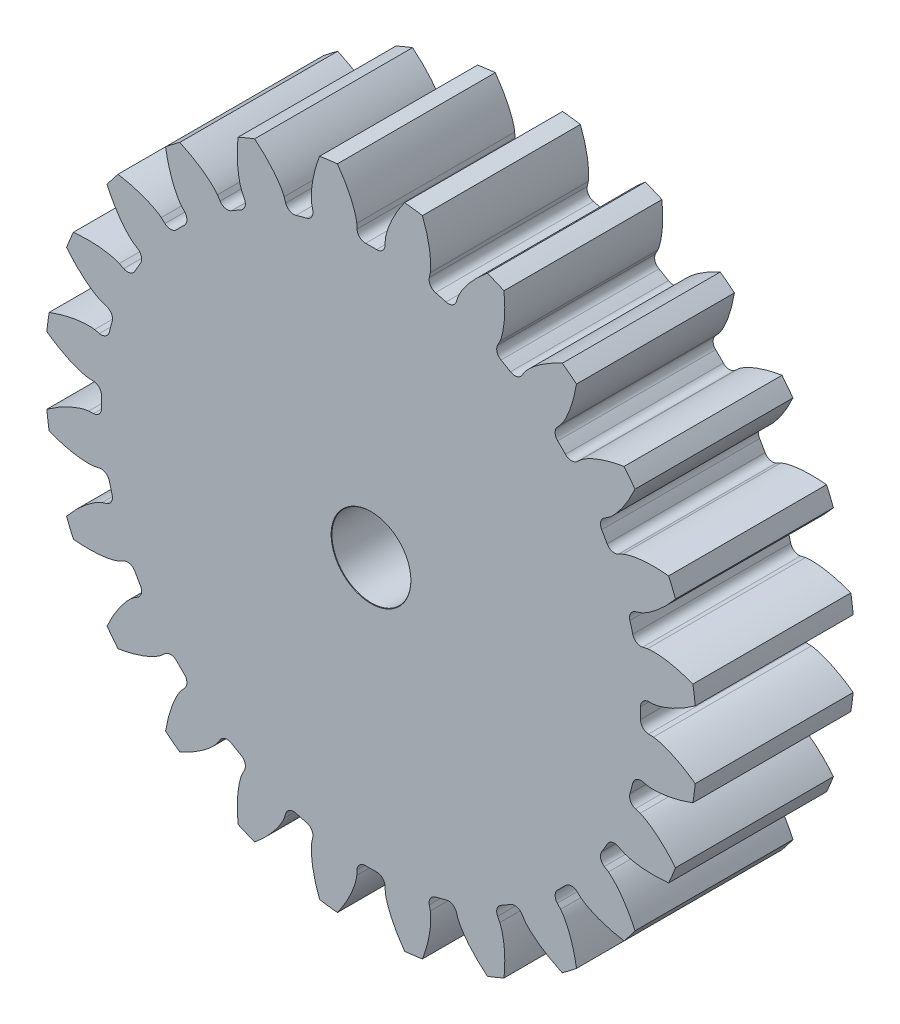
from build123d import *

# Parameters (mm, degrees)
BOSS_EXTRUDE1_DEPTH             = 5
BOSS_EXTRUDE1_DEPTH_BACK        = 5
SKETCH3_R                       = 20.6375
CUT_EXTRUDE1_DEPTH              = 30.611025185
FILLET1_R                       = 0.532614244
CIRPATTERN1_COUNT               = 24
FILLET1_OF_CIRPATTERN1_R        = 0.532614244
F_5_0MM_DOWEL_HOLE1_D           = 5
F_5_0MM_DOWEL_HOLE1_CSINK_D     = 5.05
F_5_0MM_DOWEL_HOLE1_CSINK_ANGLE = 90


with BuildPart() as part:
    # Sketch3 → Boss-Extrude1 (new, two sides: drawn at the far end of the back side and taken through both)
    with BuildSketch(Plane.XY.offset(-BOSS_EXTRUDE1_DEPTH_BACK)):
        Circle(SKETCH3_R)
    extrude(amount=BOSS_EXTRUDE1_DEPTH + BOSS_EXTRUDE1_DEPTH_BACK)

    # Sketch4 → Cut-Extrude1 (cut, symmetric)
    with BuildSketch(Plane.XY):
        with BuildLine():
            Line((17.043829637, 0.862222668), (17.87828198, 0.904436404))
            add(Edge.make_bspline(
                [(17.87828198, 0.904436404), (17.882628975, 0.904709236), (17.894811472, 0.905637892), (17.917802567, 0.908038849), (17.955248389, 0.912872306), (18.002847526, 0.920376051), (18.064221674, 0.931617626), (18.136311779, 0.946842659), (18.215294146, 0.965648432), (18.300937276, 0.988342964), (18.386106336, 1.012957224), (18.470794937, 1.039344617), (18.554900966, 1.067282274), (18.656456709, 1.103071674), (18.777769061, 1.148692039), (18.918838907, 1.20594527), (19.077937562, 1.275508259), (19.239059471, 1.351335813), (19.396736576, 1.429996177), (19.554985161, 1.514102946), (19.707341339, 1.598760729), (19.864426037, 1.691410754), (20.008834587, 1.779332437), (20.169260177, 1.883028122), (20.298332453, 1.968229709), (20.430478039, 2.060551994), (20.494617005, 2.106120696), (20.527320467, 2.129676191)],
                knots=[0, 0, 0, 0, 0, 0.005376749, 0.015083688, 0.02853182, 0.04661014, 0.064854849, 0.092110526, 0.119476176, 0.146842496, 0.174208854, 0.201574956, 0.228941013, 0.256307345, 0.307035032, 0.361767352, 0.416499661, 0.471231937, 0.525964282, 0.580696616, 0.635428982, 0.690161387, 0.744893688, 0.799626082, 0.854358407, 0.909090914, 0.909090914, 0.909090914, 0.909090914, 0.909090914], degree=4))
            ThreePointArc((20.527320467, 2.129676191), (20.6375, 0), (20.527320467, -2.129676191))
            add(Edge.make_bspline(
                [(17.87828198, -0.904436404), (17.882628975, -0.904709236), (17.894811472, -0.905637892), (17.917802567, -0.908038849), (17.955248389, -0.912872306), (18.002847526, -0.920376051), (18.064221674, -0.931617626), (18.136311779, -0.946842659), (18.215294146, -0.965648432), (18.300937276, -0.988342964), (18.386106336, -1.012957224), (18.470794937, -1.039344617), (18.554900966, -1.067282274), (18.656456709, -1.103071674), (18.777769061, -1.148692039), (18.918838907, -1.20594527), (19.077937562, -1.275508259), (19.239059471, -1.351335813), (19.396736576, -1.429996177), (19.554985161, -1.514102946), (19.707341339, -1.598760729), (19.864426037, -1.691410754), (20.008834587, -1.779332437), (20.169260177, -1.883028122), (20.298332453, -1.968229709), (20.430478039, -2.060551994), (20.494617005, -2.106120696), (20.527320467, -2.129676191)],
                knots=[0, 0, 0, 0, 0, 0.005376749, 0.015083688, 0.02853182, 0.04661014, 0.064854849, 0.092110526, 0.119476176, 0.146842496, 0.174208854, 0.201574956, 0.228941013, 0.256307345, 0.307035032, 0.361767352, 0.416499661, 0.471231937, 0.525964282, 0.580696616, 0.635428982, 0.690161387, 0.744893688, 0.799626082, 0.854358407, 0.909090914, 0.909090914, 0.909090914, 0.909090914, 0.909090914], degree=4))
            Line((17.87828198, -0.904436404), (17.043829637, -0.862222668))
            ThreePointArc((17.043829637, -0.862222668), (17.065625, 0), (17.043829637, 0.862222668))
        make_face()
    cut_extrude1 = extrude(amount=CUT_EXTRUDE1_DEPTH, both=True, mode=Mode.SUBTRACT)

    # Fillet1
    fillet1_edges = [part.edges().sort_by_distance(p)[0] for p in [
        (17.043829637, -0.862222668, 0),
        (17.043829637, 0.862222668, 0),
    ]]
    fillet(fillet1_edges, radius=FILLET1_R)

    # CirPattern1: Cut-Extrude1 ×24 about axis
    cirpattern1_axis = Axis((0, 0, 5.000000033), (0, 0, -1))
    for i in range(1, CIRPATTERN1_COUNT):
        add(cut_extrude1.rotate(cirpattern1_axis, i * 360 / CIRPATTERN1_COUNT), mode=Mode.SUBTRACT)

    # Fillet1 of CirPattern1
    fillet1_of_cirpattern1_edges = [part.edges().sort_by_distance(p)[0] for p in [
        (16.239915578, -5.244110855, 0),
        (16.686234873, -3.578424568, 0),
        (14.32927811, -9.268621553, 0),
        (15.191500778, -7.775208084, 0),
        (11.442124018, -12.66149101, 0),
        (12.66149101, -11.442124018, 0),
        (7.775208084, -15.191500778, 0),
        (9.268621553, -14.32927811, 0),
        (3.578424568, -16.686234873, 0),
        (5.244110855, -16.239915578, 0),
        (-0.862222668, -17.043829637, 0),
        (0.862222668, -17.043829637, 0),
        (-5.244110855, -16.239915578, 0),
        (-3.578424568, -16.686234873, 0),
        (-9.268621553, -14.32927811, 0),
        (-7.775208084, -15.191500778, 0),
        (-12.66149101, -11.442124018, 0),
        (-11.442124018, -12.66149101, 0),
        (-15.191500778, -7.775208084, 0),
        (-14.32927811, -9.268621553, 0),
        (-16.686234873, -3.578424568, 0),
        (-16.239915578, -5.244110855, 0),
        (-17.043829637, 0.862222668, 0),
        (-17.043829637, -0.862222668, 0),
        (-16.239915578, 5.244110855, 0),
        (-16.686234873, 3.578424568, 0),
        (-14.32927811, 9.268621553, 0),
        (-15.191500778, 7.775208084, 0),
        (-11.442124018, 12.66149101, 0),
        (-12.66149101, 11.442124018, 0),
        (-7.775208084, 15.191500778, 0),
        (-9.268621553, 14.32927811, 0),
        (-3.578424568, 16.686234873, 0),
        (-5.244110855, 16.239915578, 0),
        (0.862222668, 17.043829637, 0),
        (-0.862222668, 17.043829637, 0),
        (5.244110855, 16.239915578, 0),
        (3.578424568, 16.686234873, 0),
        (9.268621553, 14.32927811, 0),
        (7.775208084, 15.191500778, 0),
        (12.66149101, 11.442124018, 0),
        (11.442124018, 12.66149101, 0),
        (15.191500778, 7.775208084, 0),
        (14.32927811, 9.268621553, 0),
        (16.686234873, 3.578424568, 0),
        (16.239915578, 5.244110855, 0),
    ]]
    fillet(fillet1_of_cirpattern1_edges, radius=FILLET1_OF_CIRPATTERN1_R)

    # Ø5.0mm Dowel Hole1 (through all)
    with Locations(Plane.XY.offset(5.000000033)):
        with Locations((0, 0)):
            CounterSinkHole(F_5_0MM_DOWEL_HOLE1_D / 2, F_5_0MM_DOWEL_HOLE1_CSINK_D / 2, counter_sink_angle=F_5_0MM_DOWEL_HOLE1_CSINK_ANGLE)


solid = part.part
